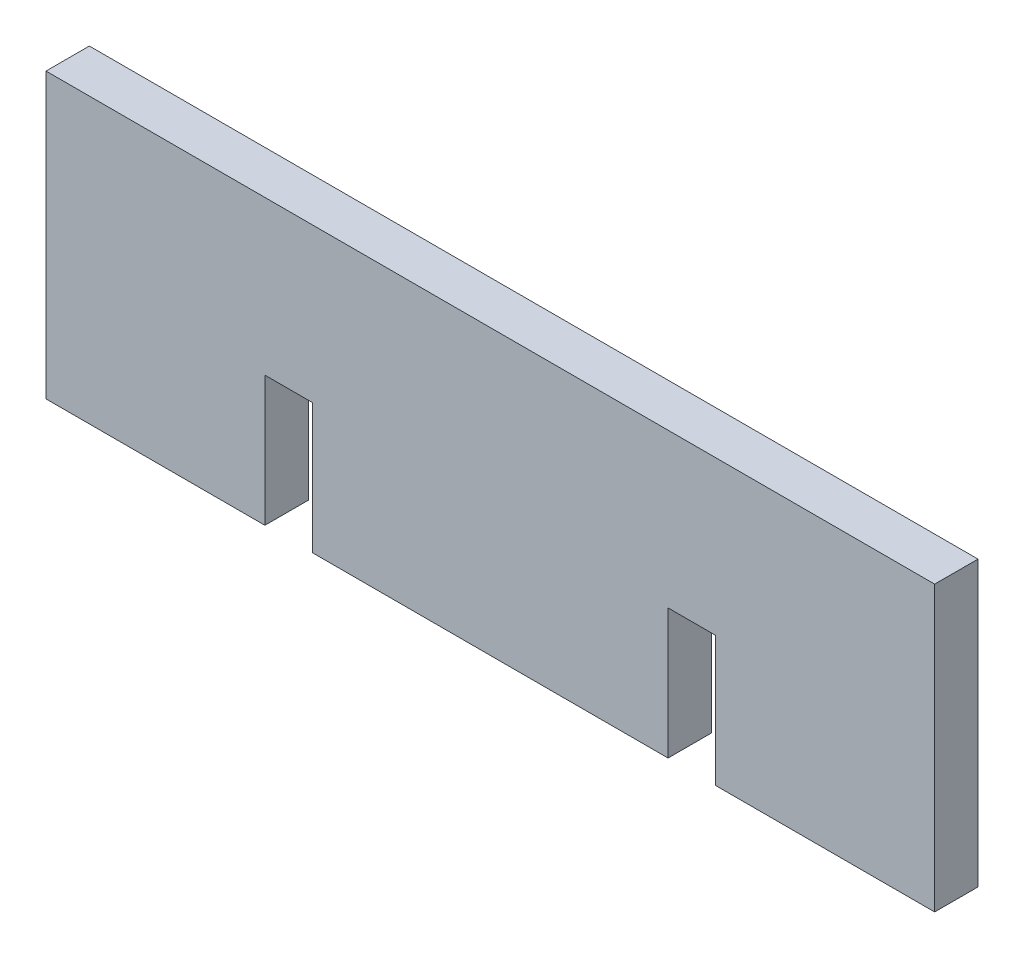
from build123d import *

# Parameters (mm, degrees)
EXTRUDE_1_DEPTH = 10


with BuildPart() as part:
    # 草图1 → 凸台-拉伸1 (new body)
    with BuildSketch(Plane.XY):
        Polygon((52, -2.75), (52, -32.75), (102.5, -32.75), (102.5, 32.75), (-102.5, 32.75), (-102.5, -32.75), (-52, -32.75), (-52, -2.75), (-41, -2.75), (-41, -32.75), (41, -32.75), (41, -2.75), align=None)
    extrude(amount=EXTRUDE_1_DEPTH)


solid = part.part
